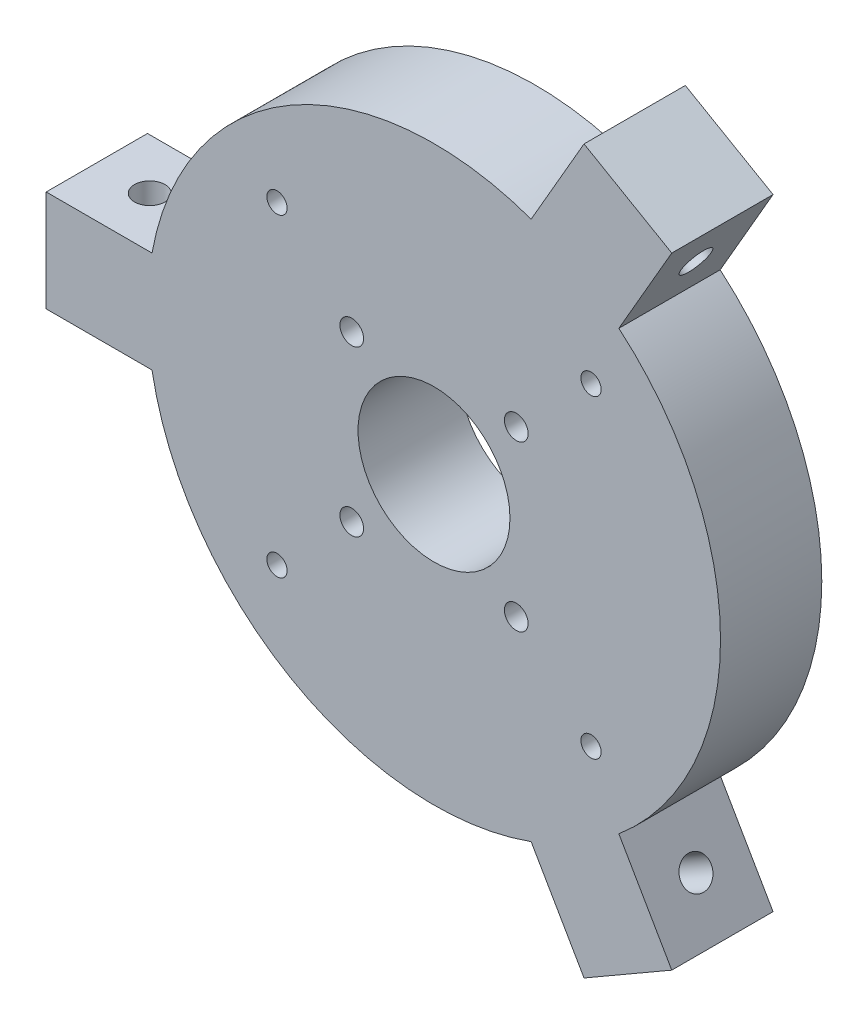
from build123d import *

# Parameters (mm, degrees)
SKETCH_1_W               = 80
SKETCH_1_H               = 80
EXTRUDE_1_DEPTH          = 20
SKETCH_2_R               = 15
CUT_EXTRUDE_1_DEPTH      = 20
SKETCH_3_R               = 2
CUT_EXTRUDE_2_DEPTH      = 20
PATTERN_CIRCULAR_1_COUNT = 4
SKETCH_4_R               = 2.34
CUT_EXTRUDE_3_DEPTH      = 20
PATTERN_CIRCULAR_2_COUNT = 4
EXTRUDE_3_DEPTH          = 20
EXTRUDE_4_DEPTH          = 20
SKETCH_7_R               = 3
CUT_EXTRUDE_4_DEPTH      = 104.412342347
PATTERN_CIRCULAR_3_COUNT = 3


with BuildPart() as part:
    # 草图1 → 凸台-拉伸1 (new body)
    with BuildSketch(Plane.XY):
        Rectangle(SKETCH_1_W, SKETCH_1_H)
    extrude(amount=EXTRUDE_1_DEPTH)

    # 草图2 → 切除-拉伸1 (cut)
    with BuildSketch(Plane.XY.offset(20)):
        Circle(SKETCH_2_R)
    extrude(amount=-CUT_EXTRUDE_1_DEPTH, mode=Mode.SUBTRACT)

    # 草图3 → 切除-拉伸2 (cut)
    with BuildSketch(Plane.XY.offset(20)):
        with Locations((31, 31)):
            Circle(SKETCH_3_R)
    cut_extrude_2 = extrude(amount=-CUT_EXTRUDE_2_DEPTH, mode=Mode.SUBTRACT)

    # 阵列(圆周)1: 切除-拉伸2 ×4 about axis
    pattern_circular_1_axis = Axis((0, 0, 0), (0, 0, 1))
    for i in range(1, PATTERN_CIRCULAR_1_COUNT):
        add(cut_extrude_2.rotate(pattern_circular_1_axis, i * 360 / PATTERN_CIRCULAR_1_COUNT), mode=Mode.SUBTRACT)

    # 草图4 → 切除-拉伸3 (cut)
    with BuildSketch(Plane.XY.offset(20)):
        with Locations((16.24, 16.24)):
            Circle(SKETCH_4_R)
    cut_extrude_3 = extrude(amount=-CUT_EXTRUDE_3_DEPTH, mode=Mode.SUBTRACT)

    # 阵列(圆周)2: 切除-拉伸3 ×4 about axis
    pattern_circular_2_axis = Axis((0, 0, 0), (0, 0, 1))
    for i in range(1, PATTERN_CIRCULAR_2_COUNT):
        add(cut_extrude_3.rotate(pattern_circular_2_axis, i * 360 / PATTERN_CIRCULAR_2_COUNT), mode=Mode.SUBTRACT)

    # 草图5 → 凸台-拉伸3 (add)
    with BuildSketch(Plane(origin=(0, 0, 0), x_dir=(-1, 0, 0), z_dir=(0, 0, -1))):
        with BuildLine():
            Line((40, 40), (40, -40))
            ThreePointArc((40, -40), (52.262518595, -21.647844006), (56.568542495, 0))
            ThreePointArc((56.568542495, 0), (52.262518595, 21.647844006), (40, 40))
        make_face()
        with BuildLine():
            ThreePointArc((-40, -40), (0, -56.568542495), (40, -40))
            Line((40, -40), (-40, -40))
        make_face()
        with BuildLine():
            ThreePointArc((-40, 40), (-56.568542495, 0), (-40, -40))
            Line((-40, -40), (-40, 40))
        make_face()
        with BuildLine():
            Line((-40, 40), (40, 40))
            ThreePointArc((40, 40), (0, 56.568542495), (-40, 40))
        make_face()
    extrude(amount=-EXTRUDE_3_DEPTH)

    # 草图6 → 凸台-拉伸4 (add)
    with BuildSketch(Plane(origin=(0, 0, 0), x_dir=(-1, 0, 0), z_dir=(0, 0, -1))):
        with BuildLine():
            Line((76.568542495, 10), (55.677643628, 10))
            ThreePointArc((55.677643628, 10), (56.345377582, 5.019803303), (56.568542495, 0))
            ThreePointArc((56.568542495, 0), (56.345377582, -5.019803303), (55.677643628, -10))
            Line((55.677643628, -10), (76.568542495, -10))
            Line((76.568542495, -10), (76.568542495, 0))
            Line((76.568542495, 0), (76.568542495, 10))
        make_face()
    extrude_4 = extrude(amount=-EXTRUDE_4_DEPTH)

    # 草图7 → 切除-拉伸4 (cut, through all)
    with BuildSketch(Plane(origin=(0, -10, 0), x_dir=(-1, 0, 0), z_dir=(0, -1, 0))):
        with Locations(Location((66.123093062, -10, 0), (0, 0, 90))):
            Circle(SKETCH_7_R)
    cut_extrude_4 = extrude(amount=-CUT_EXTRUDE_4_DEPTH, mode=Mode.SUBTRACT)

    # 阵列(圆周)3: 凸台-拉伸4, 切除-拉伸4 ×3 about axis
    pattern_circular_3_axis = Axis((0, 0, 0), (0, 0, 1))
    add([extrude_4.rotate(pattern_circular_3_axis, i * 360 / PATTERN_CIRCULAR_3_COUNT) for i in range(1, PATTERN_CIRCULAR_3_COUNT)])
    add([cut_extrude_4.rotate(pattern_circular_3_axis, i * 360 / PATTERN_CIRCULAR_3_COUNT) for i in range(1, PATTERN_CIRCULAR_3_COUNT)], mode=Mode.SUBTRACT)


solid = part.part
